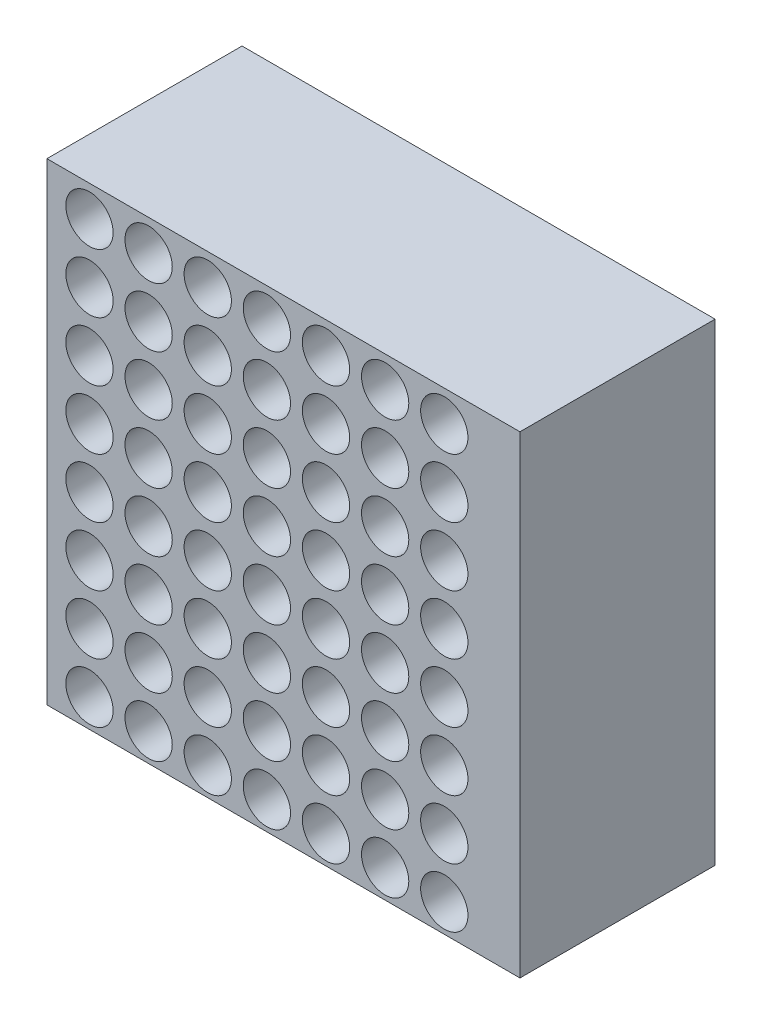
from build123d import *

# Parameters (mm, degrees)
SKETCH1_W            = 80
SKETCH1_H            = 80
BOSS_EXTRUDE1_DEPTH  = 33
SKETCH2_R            = 4
CUT_EXTRUDE1_DEPTH   = 33
LPATTERN1_COUNT      = 8
LPATTERN1_PITCH      = 10
LPATTERN1_COUNT_DIR2 = 7
LPATTERN1_PITCH_DIR2 = 10


with BuildPart() as part:
    # Sketch1 → Boss-Extrude1 (new body)
    with BuildSketch(Plane.XY):
        with Locations((-28.209195922, -3.087248322)):
            Rectangle(SKETCH1_W, SKETCH1_H)
    extrude(amount=BOSS_EXTRUDE1_DEPTH)

    # Sketch2 → Cut-Extrude1 (cut)
    with BuildSketch(Plane.XY.offset(33)):
        with Locations((-61.00943387, 31.665384742)):
            Circle(SKETCH2_R)
    cut_extrude1 = extrude(amount=-CUT_EXTRUDE1_DEPTH, mode=Mode.SUBTRACT)

    # LPattern1: Cut-Extrude1 8 × 7
    with Locations(*[(j * LPATTERN1_PITCH_DIR2, -i * LPATTERN1_PITCH, 0) for i in range(LPATTERN1_COUNT) for j in range(LPATTERN1_COUNT_DIR2) if (i, j) != (0, 0)]):
        add(cut_extrude1, mode=Mode.SUBTRACT)


solid = part.part
